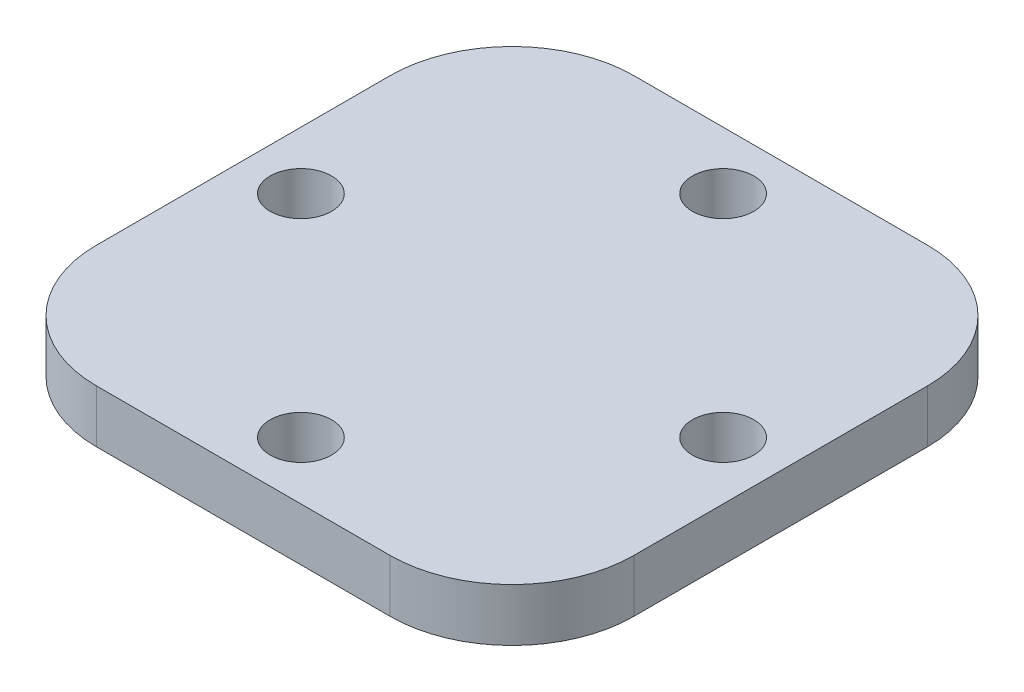
from build123d import *

# Parameters (mm, degrees)
SKETCH1_R           = 1.6
BOSS_EXTRUDE1_DEPTH = 2.75


with BuildPart() as part:
    # Sketch1 → Boss-Extrude1 (new body)
    with BuildSketch(Plane(origin=(0, 0, 0), x_dir=(1, 0, 0), z_dir=(0, 1, 0))):
        with BuildLine():
            Line((-7.65, -14), (7.65, -14))
            ThreePointArc((7.65, -14), (12.140128061, -12.140128061), (14, -7.65))
            Line((14, -7.65), (14, 7.65))
            ThreePointArc((14, 7.65), (12.140128061, 12.140128061), (7.65, 14))
            Line((7.65, 14), (-7.65, 14))
            ThreePointArc((-7.65, 14), (-12.140128061, 12.140128061), (-14, 7.65))
            Line((-14, 7.65), (-14, -7.65))
            ThreePointArc((-14, -7.65), (-12.140128061, -12.140128061), (-7.65, -14))
        make_face()
        with Locations(Location((-11, 0, 0), (0, 0, 270))):
            Circle(SKETCH1_R, mode=Mode.SUBTRACT)
        with Locations(Location((0, -11, 0), (0, 0, 270))):
            Circle(SKETCH1_R, mode=Mode.SUBTRACT)
        with Locations(Location((11, 0, 0), (0, 0, 270))):
            Circle(SKETCH1_R, mode=Mode.SUBTRACT)
        with Locations(Location((0, 11, 0), (0, 0, 270))):
            Circle(SKETCH1_R, mode=Mode.SUBTRACT)
    extrude(amount=BOSS_EXTRUDE1_DEPTH)


solid = part.part
